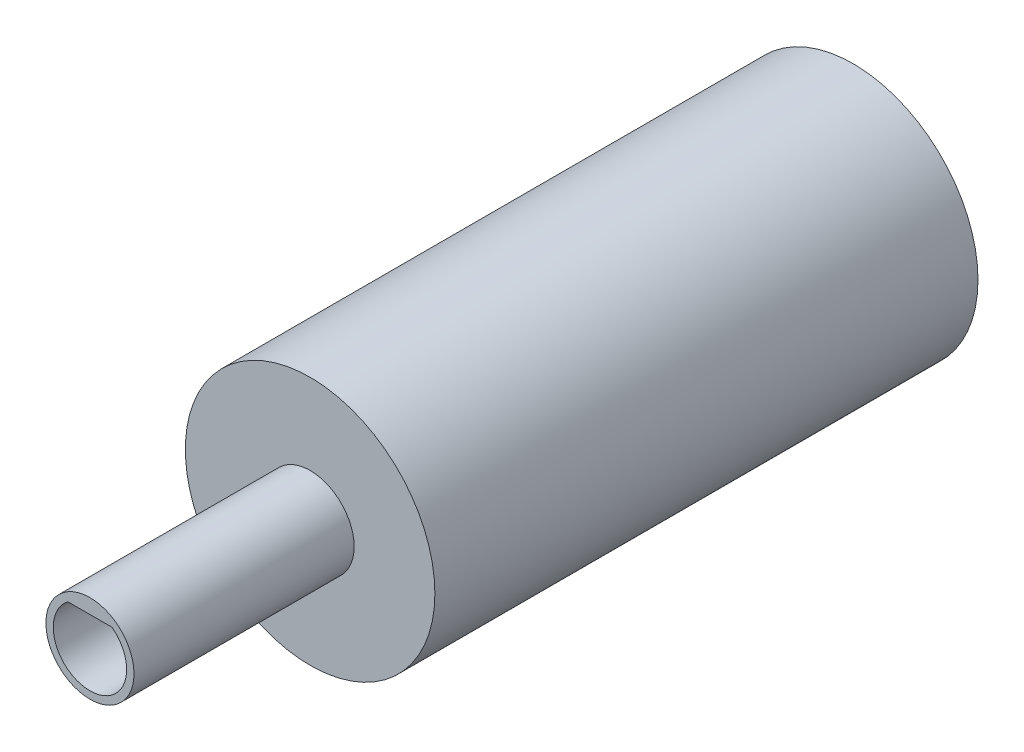
from build123d import *

# Parameters (mm, degrees)
SKETCH1_R               = 3
BOSS_EXTRUDE1_DEPTH     = 15
SKETCH2_R               = 8.5
BOSS_EXTRUDE2_DEPTH     = 5.25
SKETCH3_R               = 8.5
BOSS_EXTRUDE4_DEPTH     = 31.75
CUT_EXTRUDE4_DEPTH      = 31.75
CUT_EXTRUDE5_REACH      = 42.213
CUT_EXTRUDE5_END_RADIUS = 7.94


with BuildPart() as part:
    # Sketch1 → Boss-Extrude1 (new body)
    with BuildSketch(Plane.XY):
        Circle(SKETCH1_R)
        with BuildLine():
            Line((1.5, 2), (-1.5, 2))
            ThreePointArc((-1.5, 2), (0, -2.5), (1.5, 2))
        make_face(mode=Mode.SUBTRACT)
    extrude(amount=BOSS_EXTRUDE1_DEPTH)

    # Sketch2 → Boss-Extrude2 (add)
    with BuildSketch(Plane(origin=(0, 0, 0), x_dir=(-1, 0, 0), z_dir=(0, 0, -1))):
        with Locations(Location((0, 0, 0), (0, 0, 180))):
            Circle(SKETCH2_R)
    extrude(amount=BOSS_EXTRUDE2_DEPTH)

    # Sketch3 → Boss-Extrude4 (add)
    with BuildSketch(Plane(origin=(0, 0, -5.25), x_dir=(-1, 0, 0), z_dir=(0, 0, -1))):
        with Locations(Location((0, 0, 0), (0, 0, 180))):
            Circle(SKETCH3_R)
    extrude(amount=BOSS_EXTRUDE4_DEPTH)

    # Sketch13 → Cut-Extrude4 (cut)
    with BuildSketch(Plane(origin=(0, 0, -37), x_dir=(-1, 0, 0), z_dir=(0, 0, -1))):
        with BuildLine():
            Line((-2.39, 4.761756731), (-2.39, 7.571756731))
            ThreePointArc((-2.39, 7.571756731), (-4.693985513, -6.403912866), (7.94, 0))
            ThreePointArc((7.94, 0), (6.403912866, 4.693985513), (2.39, 7.571756731))
            Line((2.39, 7.571756731), (2.39, 4.761756731))
            Line((2.39, 4.761756731), (-2.39, 4.761756731))
        make_face()
    extrude(amount=-CUT_EXTRUDE4_DEPTH, mode=Mode.SUBTRACT)

    # Cut-Extrude5: up to this cylinder (the profile starts inside it)
    cut_extrude5_end = Plane(origin=(0, 0, -36.466151), z_dir=(0, 0, -1)) * Cylinder(CUT_EXTRUDE5_END_RADIUS, 101.306, mode=Mode.PRIVATE)
    # Sketch14 → Cut-Extrude5 (cut, up to the surface)
    with BuildSketch(Plane.XZ.offset(-4.761756731), mode=Mode.PRIVATE) as cut_extrude5_sk1:
        with BuildLine():
            Line((2.39, -37), (2.39, -34.61))
            ThreePointArc((2.39, -34.61), (1.689985208, -36.299985206), (3e-09, -37))
            Line((3e-09, -37), (2.39, -37))
        make_face()
    cut_extrude5_tool1 = extrude(cut_extrude5_sk1.sketch, amount=-CUT_EXTRUDE5_REACH, mode=Mode.PRIVATE) & cut_extrude5_end
    add(cut_extrude5_tool1.solids().sort_by_distance((1.856151, 4.761757, -36.466151))[0], mode=Mode.SUBTRACT)
    # Sketch14 → Cut-Extrude5 (cut, up to the surface)
    with BuildSketch(Plane.XZ.offset(-4.761756731), mode=Mode.PRIVATE) as cut_extrude5_sk2:
        with BuildLine():
            ThreePointArc((3e-09, -37), (-1.689985206, -36.299985208), (-2.39, -34.61))
            Line((-2.39, -34.61), (-2.39, -37))
            Line((-2.39, -37), (3e-09, -37))
        make_face()
    cut_extrude5_tool2 = extrude(cut_extrude5_sk2.sketch, amount=-CUT_EXTRUDE5_REACH, mode=Mode.PRIVATE) & cut_extrude5_end
    add(cut_extrude5_tool2.solids().sort_by_distance((-1.856151, 4.761757, -36.466151))[0], mode=Mode.SUBTRACT)


solid = part.part
